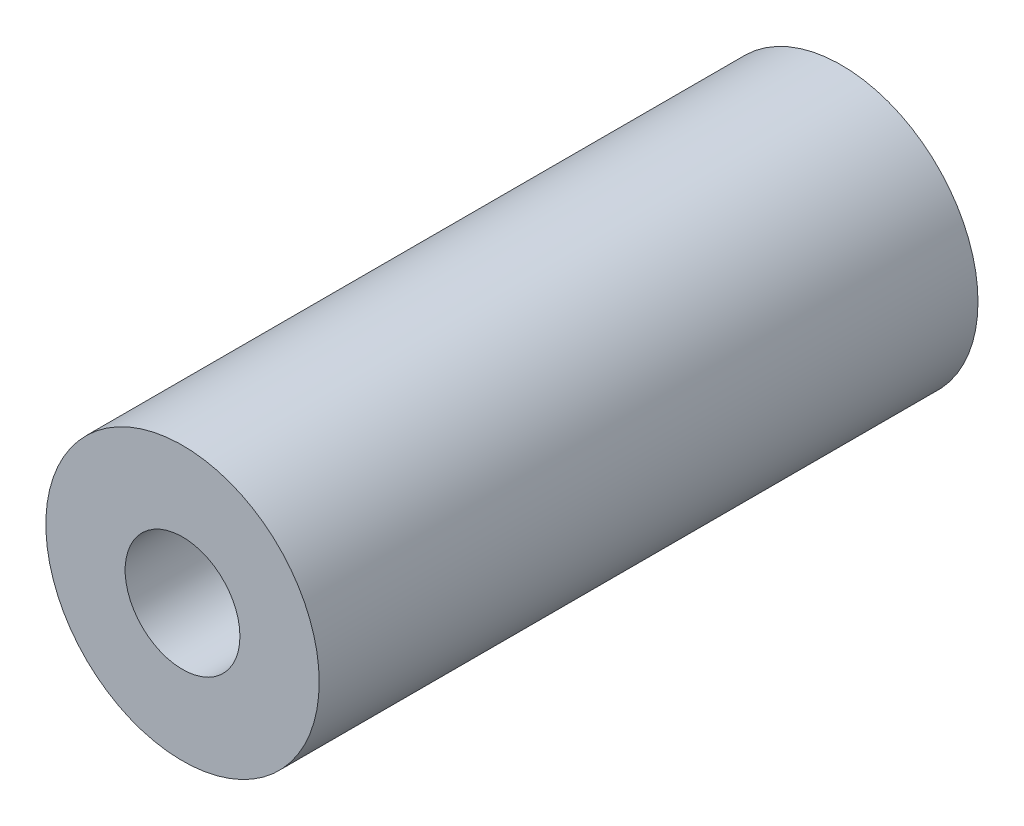
from build123d import *

# Parameters (mm, degrees)
SKETCH_1_R               = 5
EXTRUDE_1_DEPTH          = 24.1
CUT_EXTRUDE_1_DEPTH      = 26.115931199
CUT_EXTRUDE_1_DEPTH_BACK = 26.115931199
SKETCH_2_R               = 2.1


with BuildPart() as part:
    # ｽｹｯﾁ1 → ﾎﾞｽ - 押し出し1 (new body)
    with BuildSketch(Plane.XY):
        Circle(SKETCH_1_R)
    extrude(amount=EXTRUDE_1_DEPTH)

    # ｽｹｯﾁ2 → ｶｯﾄ - 押し出し1 (cut, two sides: drawn at the far end of the back side and taken through both)
    with BuildSketch(Plane.XY.offset(24.1).offset(-CUT_EXTRUDE_1_DEPTH_BACK)):
        Circle(SKETCH_2_R)
    extrude(amount=CUT_EXTRUDE_1_DEPTH + CUT_EXTRUDE_1_DEPTH_BACK, mode=Mode.SUBTRACT)


solid = part.part
